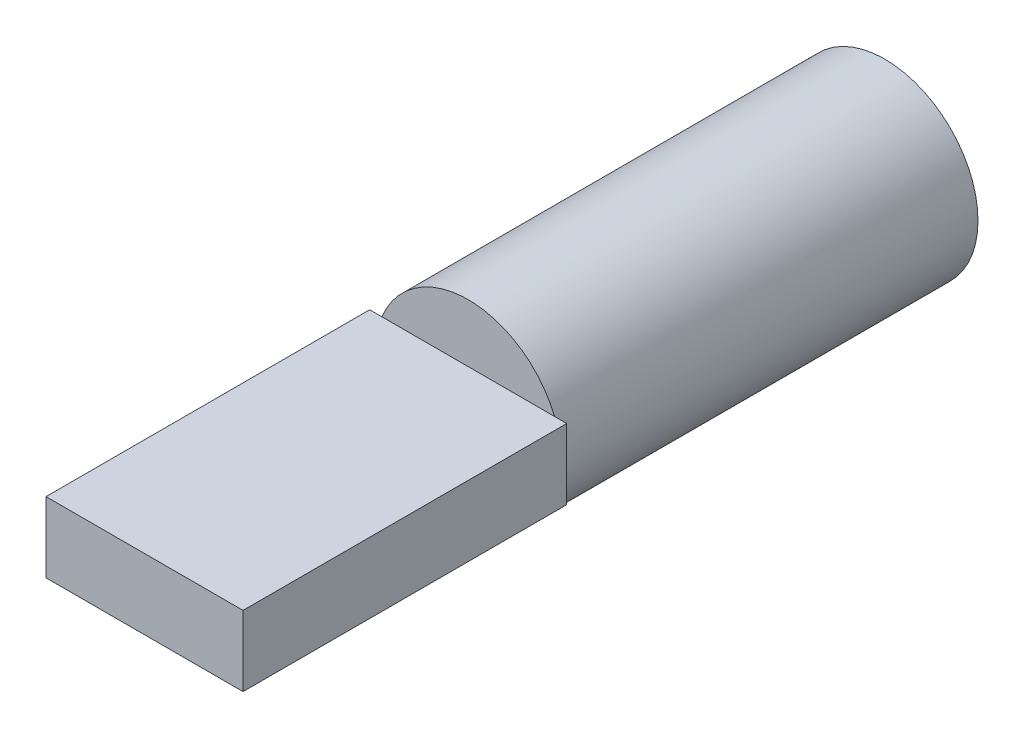
from build123d import *

# Parameters (mm, degrees)
SKETCH1_R           = 6.625
BOSS_EXTRUDE1_DEPTH = 29.6
SKETCH2_W           = 14
SKETCH2_H           = 5
BOSS_EXTRUDE2_DEPTH = 23


with BuildPart() as part:
    # Sketch1 → Boss-Extrude1 (new body)
    with BuildSketch(Plane.XY):
        Circle(SKETCH1_R)
    extrude(amount=BOSS_EXTRUDE1_DEPTH)

    # Sketch2 → Boss-Extrude2 (add)
    with BuildSketch(Plane.XY.offset(29.6)):
        Rectangle(SKETCH2_W, SKETCH2_H)
    extrude(amount=BOSS_EXTRUDE2_DEPTH)


solid = part.part
